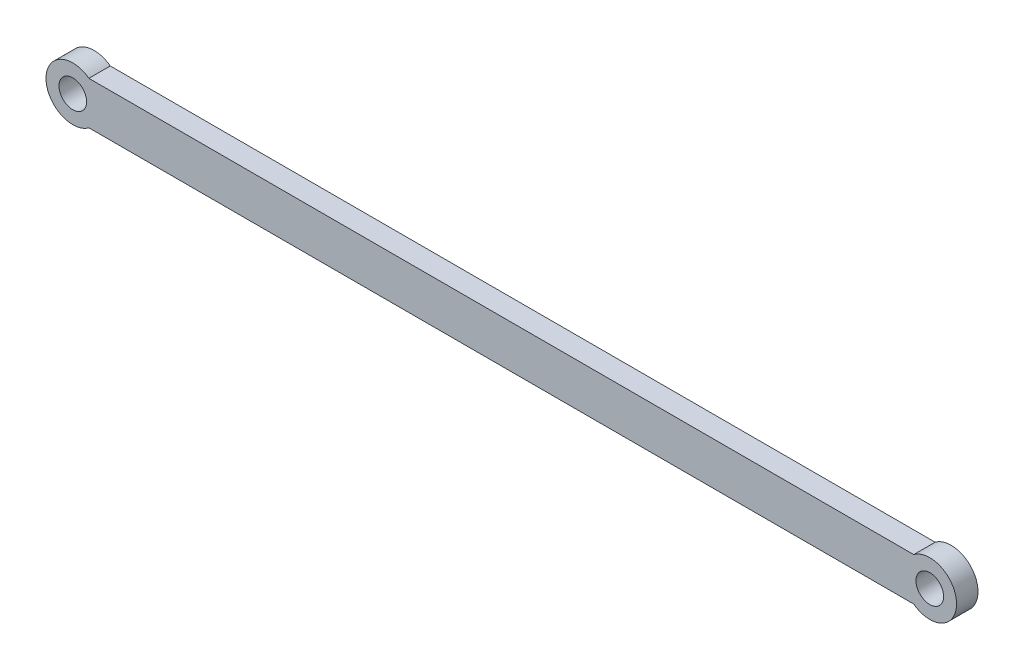
from build123d import *

# Parameters (mm, degrees)
BOSS_EXTRUDE1_DEPTH = 6.35
SKETCH2_R           = 4.09575
CUT_EXTRUDE1_DEPTH  = 6.35


with BuildPart() as part:
    # Sketch1 → Boss-Extrude1 (new body)
    with BuildSketch(Plane.XY):
        with BuildLine():
            Line((4.7625, 0), (249.2375, 0))
            ThreePointArc((249.2375, 0), (261.9375, 6.35), (249.2375, 12.7))
            Line((249.2375, 12.7), (4.7625, 12.7))
            ThreePointArc((4.7625, 12.7), (-7.9375, 6.35), (4.7625, 0))
        make_face()
    extrude(amount=BOSS_EXTRUDE1_DEPTH)

    # Sketch2 → Cut-Extrude1 (cut)
    with BuildSketch(Plane(origin=(0, 0, 0), x_dir=(-1, 0, 0), z_dir=(0, 0, -1))):
        with Locations((-254, 6.35)):
            Circle(SKETCH2_R)
        with Locations((0, 6.35)):
            Circle(SKETCH2_R)
    extrude(amount=-CUT_EXTRUDE1_DEPTH, mode=Mode.SUBTRACT)


solid = part.part
